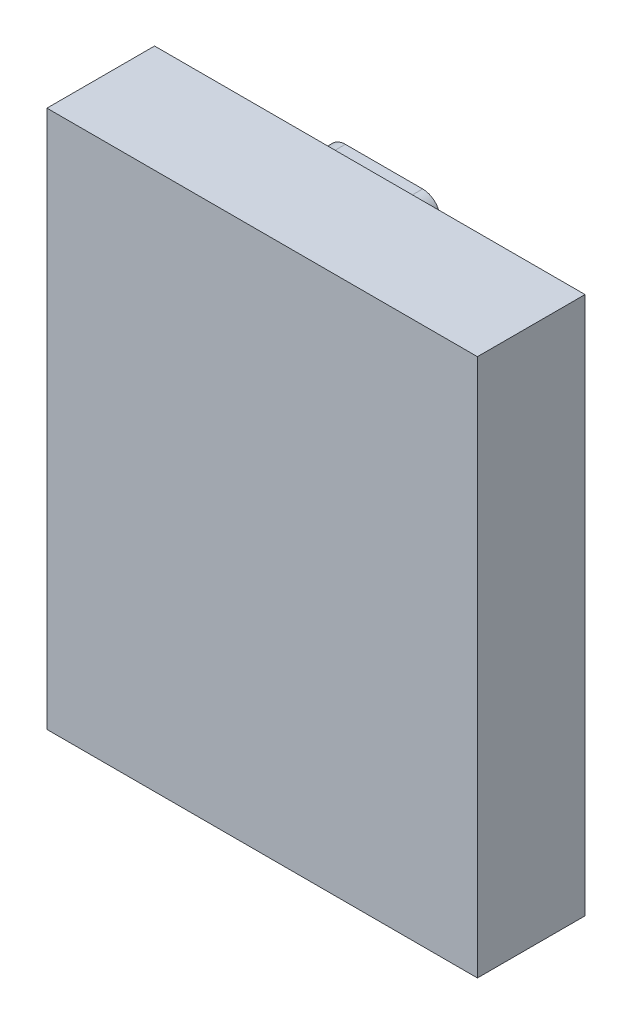
from build123d import *

# Parameters (mm, degrees)
SKETCH1_W           = 80
SKETCH1_H           = 100
BOSS_EXTRUDE1_DEPTH = 20
SKETCH2_W           = 64
SKETCH2_H           = 80
CUT_EXTRUDE1_DEPTH  = 17
BOSS_EXTRUDE2_DEPTH = 3
SKETCH5_R           = 3.199851011
CUT_EXTRUDE2_DEPTH  = 2.7
CUT_EXTRUDE3_DEPTH  = 5


with BuildPart() as part:
    # Sketch1 → Boss-Extrude1 (new body)
    with BuildSketch(Plane.XY):
        with Locations((-25.342231874, 5.71880103)):
            Rectangle(SKETCH1_W, SKETCH1_H)
    extrude(amount=BOSS_EXTRUDE1_DEPTH)

    # Sketch2 → Cut-Extrude1 (cut)
    with BuildSketch(Plane(origin=(0, 0, 0), x_dir=(-1, 0, 0), z_dir=(0, 0, -1))):
        with Locations((25.018703927, 6.11109777)):
            Rectangle(SKETCH2_W, SKETCH2_H)
    extrude(amount=-CUT_EXTRUDE1_DEPTH, mode=Mode.SUBTRACT)

    # Sketch3 → Boss-Extrude2 (add)
    with BuildSketch(Plane(origin=(0, 0, 0), x_dir=(-1, 0, 0), z_dir=(0, 0, -1))):
        with BuildLine():
            Line((18.523780304, 54.623908994), (32.891231828, 54.623908994))
            ThreePointArc((32.891231828, 54.623908994), (36.178699549, 51.336441272), (32.891231828, 48.048973551))
            Line((32.891231828, 48.048973551), (18.523780304, 48.048973551))
            ThreePointArc((18.523780304, 48.048973551), (15.236312582, 51.336441272), (18.523780304, 54.623908994))
        make_face()
    extrude(amount=BOSS_EXTRUDE2_DEPTH)

    # Sketch5 → Cut-Extrude2 (cut)
    with BuildSketch(Plane(origin=(0, 0, 0), x_dir=(-1, 0, 0), z_dir=(0, 0, -1))):
        with Locations((-0.897871535, 51.161432221)):
            Circle(SKETCH5_R)
    extrude(amount=-CUT_EXTRUDE2_DEPTH, mode=Mode.SUBTRACT)

    # Sketch8 → Cut-Extrude3 (cut)
    with BuildSketch(Plane.XZ.offset(44.28119897)):
        with BuildLine():
            Line((-58.0956261, 11.534398485), (-49.77573211, 11.534398485))
            ThreePointArc((-49.77573211, 11.534398485), (-48.168479863, 9.927146237), (-49.77573211, 8.319893989))
            Line((-49.77573211, 8.319893989), (-58.0956261, 8.319893989))
            ThreePointArc((-58.0956261, 8.319893989), (-59.702878348, 9.927146237), (-58.0956261, 11.534398485))
        make_face()
    extrude(amount=-CUT_EXTRUDE3_DEPTH, mode=Mode.SUBTRACT)


solid = part.part
